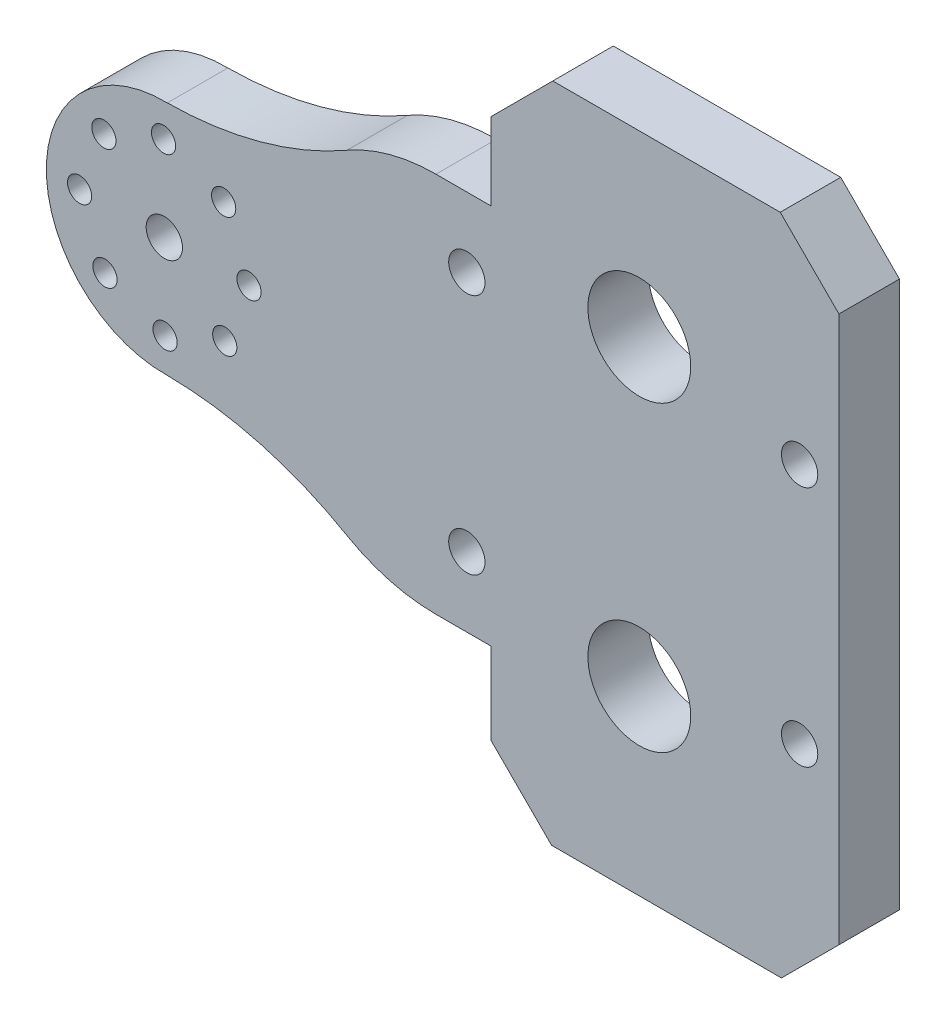
from build123d import *

# Parameters (mm, degrees)
SKETCH1_R           = 1.5
SKETCH1_R_2         = 4.25
SKETCH1_R_3         = 1
BOSS_EXTRUDE2_DEPTH = 5


with BuildPart() as part:
    # Sketch1 → Boss-Extrude2 (new body)
    with BuildSketch(Plane.XY):
        with BuildLine():
            Line((45.25091594, -25.207708346), (50.00091594, -20.457708346))
            Line((50.00091594, -20.457708346), (50.00091594, 24.688738263))
            Line((50.00091594, 24.688738263), (45.147362549, 29.542291654))
            Line((45.147362549, 29.542291654), (26.35446933, 29.542291654))
            Line((26.35446933, 29.542291654), (21.25091594, 24.438738263))
            Line((21.25091594, 24.438738263), (21.25091594, 18.042291654))
            Line((21.25091594, 18.042291654), (20.408095363, 18.042291654))
            Line((20.408095363, 18.042291654), (16.70086026, 18.042291654))
            ThreePointArc((16.70086026, 18.042291654), (12.892426636, 17.542145454), (9.3422674, 16.075624987))
            ThreePointArc((9.3422674, 16.075624987), (2.182128173, 13.100539865), (-5.49908406, 12.043324729))
            Line((-5.49908406, 12.043324729), (-5.49908406, 12.039085999))
            ThreePointArc((-5.49908406, 12.039085999), (-15.49908406, 2.292291654), (-5.49908406, -7.454502691))
            Line((-5.49908406, -7.454502691), (-5.49908406, -7.458741422))
            ThreePointArc((-5.49908406, -7.458741422), (2.182128173, -8.515956557), (9.3422674, -11.491041679))
            ThreePointArc((9.3422674, -11.491041679), (12.892426636, -12.957562146), (16.70086026, -13.457708346))
            Line((16.70086026, -13.457708346), (20.408095363, -13.457708346))
            Line((20.408095363, -13.457708346), (21.25091594, -13.457708346))
            Line((21.25091594, -13.457708346), (21.25091594, -20.207708346))
            Line((21.25091594, -20.207708346), (26.25091594, -25.207708346))
            Line((26.25091594, -25.207708346), (45.25091594, -25.207708346))
        make_face()
        with Locations((46.75091594, -7.707708346)):
            Circle(SKETCH1_R, mode=Mode.SUBTRACT)
        with Locations((46.75091594, 12.292291654)):
            Circle(SKETCH1_R, mode=Mode.SUBTRACT)
        with Locations((33.50091594, 14.792291654)):
            Circle(SKETCH1_R_2, mode=Mode.SUBTRACT)
        with Locations((33.50091594, -10.207708346)):
            Circle(SKETCH1_R_2, mode=Mode.SUBTRACT)
        with Locations((19.25091594, 12.292291654)):
            Circle(SKETCH1_R, mode=Mode.SUBTRACT)
        with Locations((19.25091594, -7.707708346)):
            Circle(SKETCH1_R, mode=Mode.SUBTRACT)
        with Locations((-5.74908406, 2.292291654)):
            Circle(SKETCH1_R, mode=Mode.SUBTRACT)
        with Locations((1.25091594, 2.354746229)):
            Circle(SKETCH1_R_3, mode=Mode.SUBTRACT)
        with Locations((-0.755373293, -2.613098521)):
            Circle(SKETCH1_R_3, mode=Mode.SUBTRACT)
        with Locations((-5.686629485, -4.707708346)):
            Circle(SKETCH1_R_3, mode=Mode.SUBTRACT)
        with Locations((-10.654474236, -2.701419114)):
            Circle(SKETCH1_R_3, mode=Mode.SUBTRACT)
        with Locations((-12.74908406, 2.229837079)):
            Circle(SKETCH1_R_3, mode=Mode.SUBTRACT)
        with Locations((-10.742794828, 7.197681829)):
            Circle(SKETCH1_R_3, mode=Mode.SUBTRACT)
        with Locations((-5.811538636, 9.292291654)):
            Circle(SKETCH1_R_3, mode=Mode.SUBTRACT)
        with Locations((-0.843693885, 7.286002421)):
            Circle(SKETCH1_R_3, mode=Mode.SUBTRACT)
    extrude(amount=BOSS_EXTRUDE2_DEPTH)


solid = part.part
